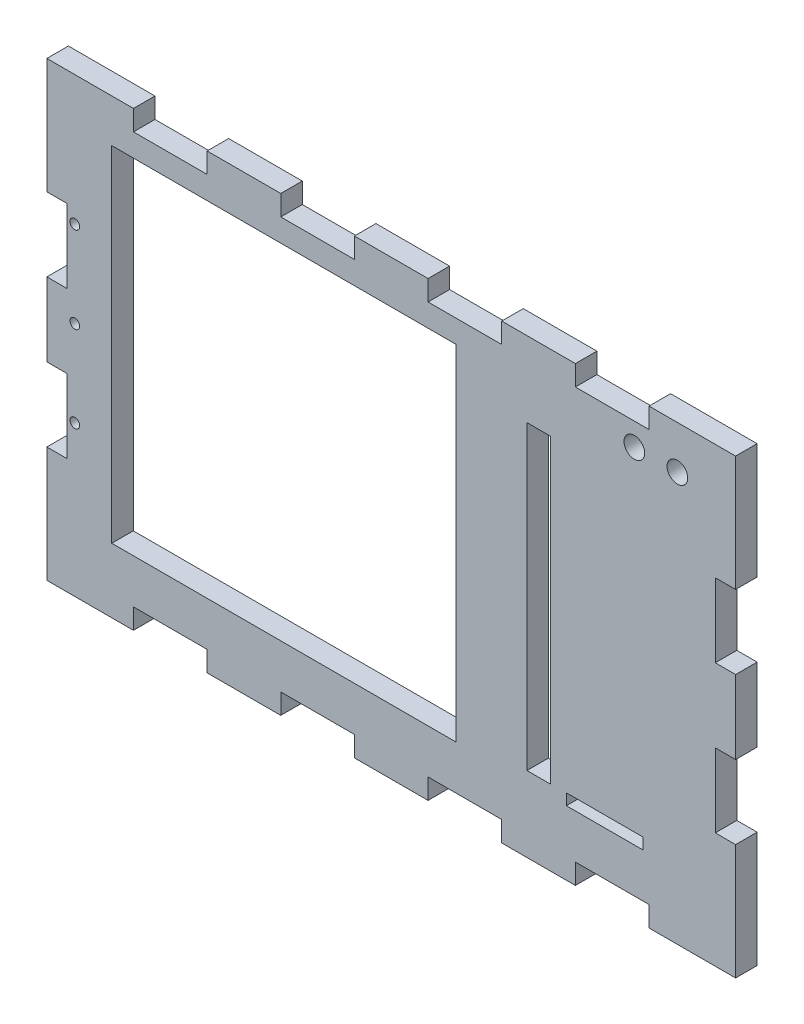
from build123d import *

# Parameters (mm, degrees)
BOSS_EXTRUDE1_DEPTH     = 6.35
CUT_EXTRUDE1_DEPTH      = 244.131209432
CUT_EXTRUDE1_DEPTH_BACK = 244.131209432
SKETCH4_W               = 101.6
SKETCH4_H               = 101.6
SKETCH4_W_2             = 22.606
SKETCH4_H_2             = 3.302
SKETCH5_W               = 6.888524177
SKETCH5_H               = 88.9
CUT_EXTRUDE2_DEPTH      = 6.35
SKETCH6_R               = 1.429315601
CUT_EXTRUDE3_DEPTH      = 13.97


with BuildPart() as part:
    # Sketch3 → Boss-Extrude1 (new body)
    with BuildSketch(Plane.XY):
        Polygon((0, 77.53985), (0, 55.81015), (5.9944, 55.81015), (5.9944, 34.08045), (0, 34.08045), (0, 12.35075), (0, 0), (25.54605, 0), (25.54605, 5.9944), (47.27575, 5.9944), (47.27575, 0), (69.00545, 0), (69.00545, 5.9944), (90.73515, 5.9944), (90.73515, 0), (112.46485, 0), (112.46485, 5.9944), (134.19455, 5.9944), (134.19455, 0), (155.92425, 0), (155.92425, 5.9944), (177.65395, 5.9944), (177.65395, 0), (203.2, 0), (203.2, 34.08045), (197.2056, 34.08045), (197.2056, 55.81015), (203.2, 55.81015), (203.2, 77.53985), (197.2056, 77.53985), (197.2056, 99.26955), (203.2, 99.26955), (203.2, 120.99925), (203.2, 133.35), (177.65395, 133.35), (177.65395, 127.3556), (155.92425, 127.3556), (155.92425, 133.35), (134.19455, 133.35), (134.19455, 127.3556), (112.46485, 127.3556), (112.46485, 133.35), (90.73515, 133.35), (90.73515, 127.3556), (69.00545, 127.3556), (69.00545, 133.35), (47.27575, 133.35), (47.27575, 127.3556), (25.54605, 127.3556), (25.54605, 133.35), (0, 133.35), (0, 99.26955), (5.9944, 99.26955), (5.9944, 77.53985), align=None)
    extrude(amount=BOSS_EXTRUDE1_DEPTH)

    # Sketch4 → Cut-Extrude1 (cut, two sides: drawn at the far end of the back side and taken through both)
    with BuildSketch(Plane.XY.offset(6.35).offset(-CUT_EXTRUDE1_DEPTH_BACK)):
        with Locations((69.942028986, 69.85)):
            Rectangle(SKETCH4_W, SKETCH4_H)
        with BuildLine():
            ThreePointArc((189.068028986, 120.65), (186.020028986, 123.698), (182.972028986, 120.65))
            Line((182.972028986, 120.65), (189.068028986, 120.65))
        make_face()
        with BuildLine():
            Line((189.068028986, 120.65), (182.972028986, 120.65))
            ThreePointArc((182.972028986, 120.65), (186.020028986, 117.602), (189.068028986, 120.65))
        make_face()
        with BuildLine():
            ThreePointArc((176.368028986, 120.65), (173.320028986, 123.698), (170.272028986, 120.65))
            Line((170.272028986, 120.65), (176.368028986, 120.65))
        make_face()
        with BuildLine():
            Line((176.368028986, 120.65), (170.272028986, 120.65))
            ThreePointArc((170.272028986, 120.65), (173.320028986, 117.602), (176.368028986, 120.65))
        make_face()
        with Locations((164.557028986, 20.701)):
            Rectangle(SKETCH4_W_2, SKETCH4_H_2)
    extrude(amount=CUT_EXTRUDE1_DEPTH + CUT_EXTRUDE1_DEPTH_BACK, mode=Mode.SUBTRACT)

    # Sketch5 → Cut-Extrude2 (cut)
    with BuildSketch(Plane(origin=(0, 0, 0), x_dir=(-1, 0, 0), z_dir=(0, 0, -1))):
        with Locations((-145.073671488, 66.675)):
            Rectangle(SKETCH5_W, SKETCH5_H)
    extrude(amount=-CUT_EXTRUDE2_DEPTH, mode=Mode.SUBTRACT)

    # Sketch6 → Cut-Extrude3 (cut)
    with BuildSketch(Plane.XY.offset(6.35)):
        with Locations((8.25, 95.142010497)):
            Circle(SKETCH6_R)
        with Locations((8.25, 69.742010497)):
            Circle(SKETCH6_R)
        with Locations((8.25, 44.342010497)):
            Circle(SKETCH6_R)
    extrude(amount=-CUT_EXTRUDE3_DEPTH, mode=Mode.SUBTRACT)


solid = part.part
